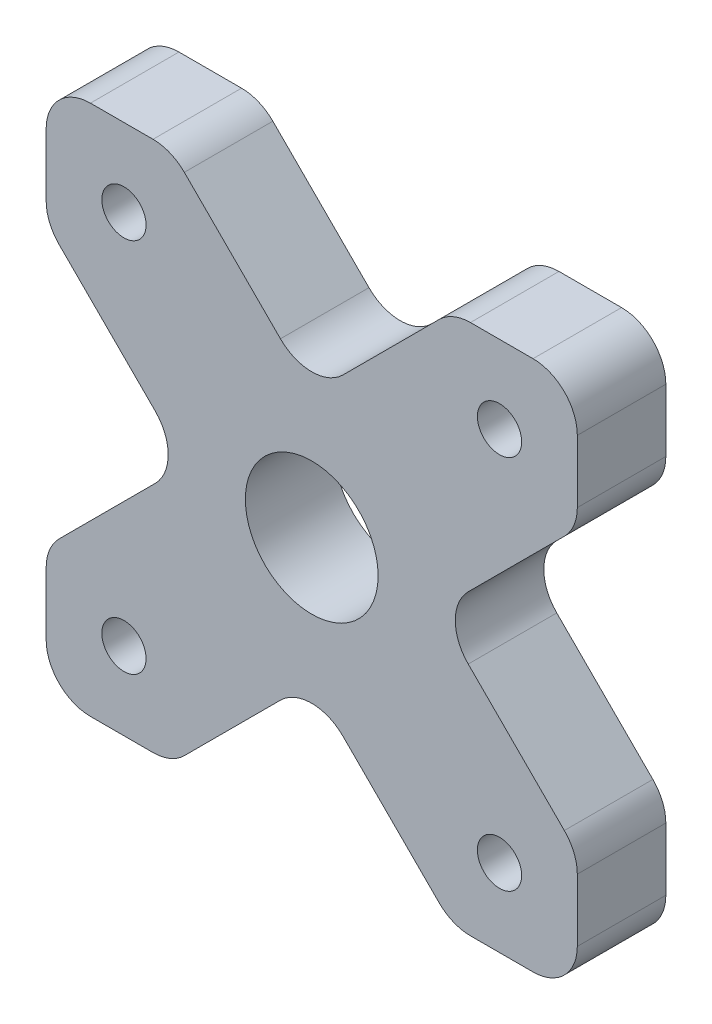
from build123d import *

# Parameters (mm, degrees)
SKETCH1_R           = 2.5
SKETCH1_R_2         = 7.5
BOSS_EXTRUDE1_DEPTH = 10


with BuildPart() as part:
    # Sketch1 → Boss-Extrude1 (new body)
    with BuildSketch(Plane.XY):
        with BuildLine():
            Line((17.928932188, 30), (25, 30))
            ThreePointArc((25, 30), (28.535533906, 28.535533906), (30, 25))
            Line((30, 25), (30, 17.928932188))
            ThreePointArc((30, 17.928932188), (29.619397663, 16.015515026), (28.535533906, 14.393398282))
            Line((28.535533906, 14.393398282), (17.67766953, 3.535533906))
            ThreePointArc((17.67766953, 3.535533906), (16.213203436, 0), (17.67766953, -3.535533906))
            Line((17.67766953, -3.535533906), (28.535533906, -14.393398282))
            ThreePointArc((28.535533906, -14.393398282), (29.619397663, -16.015515026), (30, -17.928932188))
            Line((30, -17.928932188), (30, -25))
            ThreePointArc((30, -25), (28.535533906, -28.535533906), (25, -30))
            Line((25, -30), (17.928932188, -30))
            ThreePointArc((17.928932188, -30), (16.015515026, -29.619397663), (14.393398282, -28.535533906))
            Line((14.393398282, -28.535533906), (3.535533906, -17.67766953))
            ThreePointArc((3.535533906, -17.67766953), (0, -16.213203436), (-3.535533906, -17.67766953))
            Line((-3.535533906, -17.67766953), (-14.393398282, -28.535533906))
            ThreePointArc((-14.393398282, -28.535533906), (-16.015515026, -29.619397663), (-17.928932188, -30))
            Line((-17.928932188, -30), (-25, -30))
            ThreePointArc((-25, -30), (-28.535533906, -28.535533906), (-30, -25))
            Line((-30, -25), (-30, -17.928932188))
            ThreePointArc((-30, -17.928932188), (-29.619397663, -16.015515026), (-28.535533906, -14.393398282))
            Line((-28.535533906, -14.393398282), (-17.67766953, -3.535533906))
            ThreePointArc((-17.67766953, -3.535533906), (-16.213203436, 0), (-17.67766953, 3.535533906))
            Line((-17.67766953, 3.535533906), (-28.535533906, 14.393398282))
            ThreePointArc((-28.535533906, 14.393398282), (-29.619397663, 16.015515026), (-30, 17.928932188))
            Line((-30, 17.928932188), (-30, 25))
            ThreePointArc((-30, 25), (-28.535533906, 28.535533906), (-25, 30))
            Line((-25, 30), (-17.928932188, 30))
            ThreePointArc((-17.928932188, 30), (-16.015515026, 29.619397663), (-14.393398282, 28.535533906))
            Line((-14.393398282, 28.535533906), (-3.535533906, 17.67766953))
            ThreePointArc((-3.535533906, 17.67766953), (0, 16.213203436), (3.535533906, 17.67766953))
            Line((3.535533906, 17.67766953), (14.393398282, 28.535533906))
            ThreePointArc((14.393398282, 28.535533906), (16.015515026, 29.619397663), (17.928932188, 30))
        make_face()
        with Locations((-21.213203436, 21.213203436)):
            Circle(SKETCH1_R, mode=Mode.SUBTRACT)
        with Locations((21.213203436, 21.213203436)):
            Circle(SKETCH1_R, mode=Mode.SUBTRACT)
        with Locations((21.213203436, -21.213203436)):
            Circle(SKETCH1_R, mode=Mode.SUBTRACT)
        with Locations((-21.213203436, -21.213203436)):
            Circle(SKETCH1_R, mode=Mode.SUBTRACT)
        Circle(SKETCH1_R_2, mode=Mode.SUBTRACT)
    extrude(amount=BOSS_EXTRUDE1_DEPTH)


solid = part.part
